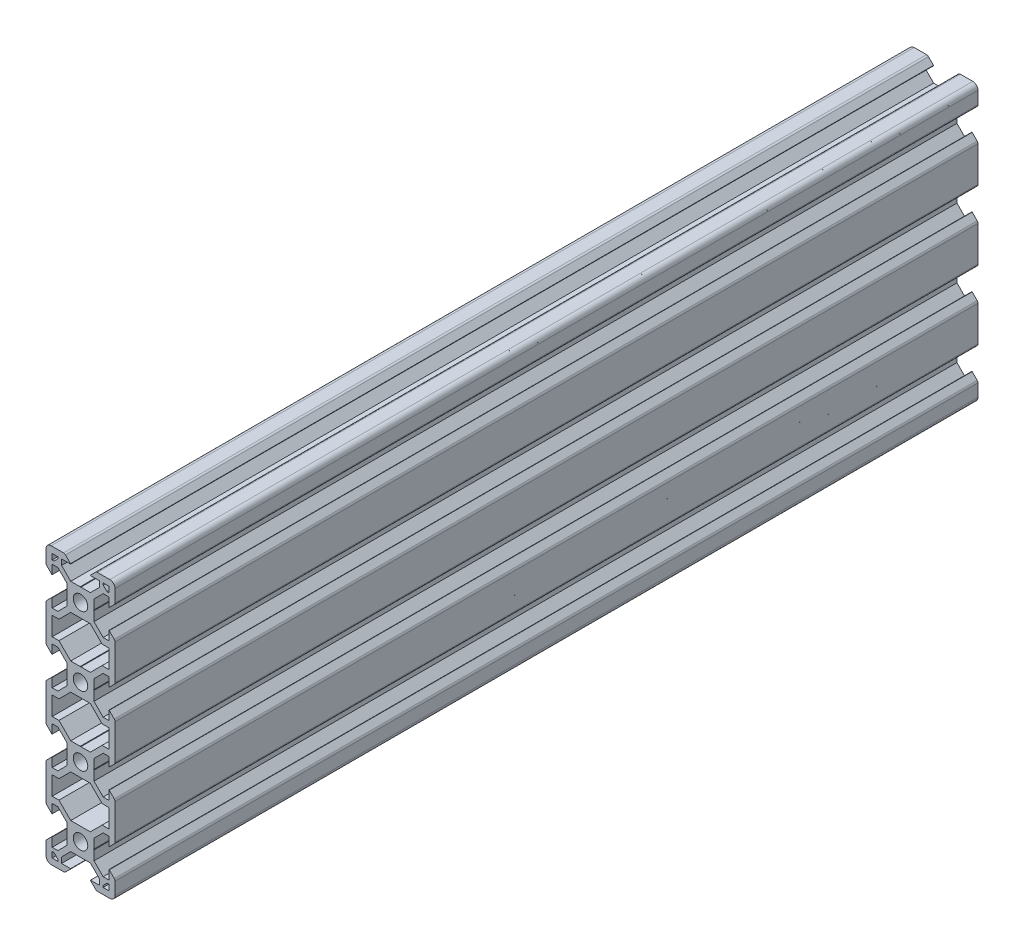
from build123d import *

# Parameters (mm, degrees)
SKETCH3_R           = 2.1
BOSS_EXTRUDE1_DEPTH = 250


with BuildPart() as part:
    # Sketch3 → Boss-Extrude1 (new body)
    with BuildSketch(Plane.XY):
        with BuildLine():
            Line((-0.1, 3.9), (0, 3.8))
            Line((0, 3.8), (0.1, 3.9))
            Line((0.1, 3.9), (2.840365134, 3.9))
            Line((2.840365134, 3.9), (5.5, 6.558825842))
            Line((5.5, 6.558825842), (5.5, 8.197505675))
            Line((5.5, 8.197505675), (2.89, 8.197505675))
            Line((2.89, 8.197505675), (2.89, 8.307505675))
            Line((2.89, 8.307505675), (4.348614357, 9.766120032))
            ThreePointArc((4.348614357, 9.766120032), (4.604908803, 9.937370505), (4.907228714, 9.997505675))
            Line((4.907228714, 9.997505675), (8.5, 9.997505675))
            ThreePointArc((8.5, 9.997505675), (9.560660172, 9.558165846), (10, 8.497505675))
            Line((10, 8.497505675), (10, 4.904734389))
            ThreePointArc((10, 4.904734389), (9.939864831, 4.602414477), (9.768614357, 4.346120032))
            Line((9.768614357, 4.346120032), (8.31, 2.887505675))
            Line((8.31, 2.887505675), (8.2, 2.887505675))
            Line((8.2, 2.887505675), (8.2, 5.497505675))
            Line((8.2, 5.497505675), (6.56, 5.497505675))
            Line((6.56, 5.497505675), (3.9, 2.83831481))
            Line((3.9, 2.83831481), (3.9, 0.1))
            Line((3.9, 0.1), (3.8, 0))
            Line((3.8, 0), (3.9, -0.1))
            Line((3.9, -0.1), (3.9, -2.84))
            Line((3.9, -2.84), (6.56, -5.5))
            Line((6.56, -5.5), (8.21, -5.5))
            Line((8.21, -5.5), (8.21, -2.89))
            Line((8.21, -2.89), (8.31, -2.89))
            Line((8.31, -2.89), (9.765685425, -4.345685425))
            ThreePointArc((9.765685425, -4.345685425), (9.939103626, -4.605224104), (10, -4.91137085))
            Line((10, -4.91137085), (10, -15.08862915))
            ThreePointArc((10, -15.08862915), (9.939103626, -15.394775896), (9.765685425, -15.654314575))
            Line((9.765685425, -15.654314575), (8.31, -17.11))
            Line((8.31, -17.11), (8.21, -17.11))
            Line((8.21, -17.11), (8.21, -14.5))
            Line((8.21, -14.5), (6.56, -14.5))
            Line((6.56, -14.5), (3.9, -17.16))
            Line((3.9, -17.16), (3.9, -19.9))
            Line((3.9, -19.9), (3.8, -20))
            Line((3.8, -20), (3.9, -20.1))
            Line((3.9, -20.1), (3.9, -22.838679656))
            Line((3.9, -22.838679656), (6.56, -25.498679656))
            Line((6.56, -25.498679656), (8.21, -25.498679656))
            Line((8.21, -25.498679656), (8.21, -22.888679656))
            Line((8.21, -22.888679656), (8.31, -22.888679656))
            Line((8.31, -22.888679656), (9.765685425, -24.344365081))
            ThreePointArc((9.765685425, -24.344365081), (9.939103626, -24.60390376), (10, -24.910050506))
            Line((10, -24.910050506), (10, -35.109949494))
            ThreePointArc((10, -35.109949494), (9.939103626, -35.41609624), (9.765685425, -35.675634919))
            Line((9.765685425, -35.675634919), (8.31, -37.131320344))
            Line((8.31, -37.131320344), (8.21, -37.131320344))
            Line((8.21, -37.131320344), (8.21, -34.521320344))
            Line((8.21, -34.521320344), (6.56, -34.521320344))
            Line((6.56, -34.521320344), (3.9, -37.181320344))
            Line((3.9, -37.181320344), (3.9, -39.92))
            Line((3.9, -39.92), (3.8, -40.02))
            Line((3.8, -40.02), (3.9, -40.12))
            Line((3.9, -40.12), (3.9, -42.86))
            Line((3.9, -42.86), (6.56, -45.52))
            Line((6.56, -45.52), (8.21, -45.52))
            Line((8.21, -45.52), (8.21, -42.91))
            Line((8.21, -42.91), (8.31, -42.91))
            Line((8.31, -42.91), (9.765685425, -44.365685425))
            ThreePointArc((9.765685425, -44.365685425), (9.939103626, -44.625224104), (10, -44.93137085))
            Line((10, -44.93137085), (10, -55.10862915))
            ThreePointArc((10, -55.10862915), (9.939103626, -55.414775896), (9.765685425, -55.674314575))
            Line((9.765685425, -55.674314575), (8.31, -57.13))
            Line((8.31, -57.13), (8.21, -57.13))
            Line((8.21, -57.13), (8.21, -54.52))
            Line((8.21, -54.52), (6.56, -54.52))
            Line((6.56, -54.52), (3.9, -57.18))
            Line((3.9, -57.18), (3.9, -59.92))
            Line((3.9, -59.92), (3.8, -60.02))
            Line((3.8, -60.02), (3.9, -60.12))
            Line((3.9, -60.12), (3.9, -62.85831481))
            Line((3.9, -62.85831481), (6.56, -65.517505675))
            Line((6.56, -65.517505675), (8.2, -65.517505675))
            Line((8.2, -65.517505675), (8.2, -62.907505675))
            Line((8.2, -62.907505675), (8.31, -62.907505675))
            Line((8.31, -62.907505675), (9.768614357, -64.366120032))
            ThreePointArc((9.768614357, -64.366120032), (9.939864831, -64.622414477), (10, -64.924734389))
            Line((10, -64.924734389), (10, -68.517505675))
            ThreePointArc((10, -68.517505675), (9.560660172, -69.578165846), (8.5, -70.017505675))
            Line((8.5, -70.017505675), (4.907228714, -70.017505675))
            ThreePointArc((4.907228714, -70.017505675), (4.604908803, -69.957370505), (4.348614357, -69.786120032))
            Line((4.348614357, -69.786120032), (2.89, -68.327505675))
            Line((2.89, -68.327505675), (2.89, -68.217505675))
            Line((2.89, -68.217505675), (5.5, -68.217505675))
            Line((5.5, -68.217505675), (5.5, -66.578825842))
            Line((5.5, -66.578825842), (2.840365134, -63.92))
            Line((2.840365134, -63.92), (0.1, -63.92))
            Line((0.1, -63.92), (0, -63.82))
            Line((0, -63.82), (-0.1, -63.92))
            Line((-0.1, -63.92), (-2.840365134, -63.92))
            Line((-2.840365134, -63.92), (-5.5, -66.578825842))
            Line((-5.5, -66.578825842), (-5.5, -68.217505675))
            Line((-5.5, -68.217505675), (-2.89, -68.217505675))
            Line((-2.89, -68.217505675), (-2.89, -68.327505675))
            Line((-2.89, -68.327505675), (-4.348614357, -69.786120032))
            ThreePointArc((-4.348614357, -69.786120032), (-4.604908803, -69.957370505), (-4.907228714, -70.017505675))
            Line((-4.907228714, -70.017505675), (-8.5, -70.017505675))
            ThreePointArc((-8.5, -70.017505675), (-9.560660172, -69.578165846), (-10, -68.517505675))
            Line((-10, -68.517505675), (-10, -64.924734389))
            ThreePointArc((-10, -64.924734389), (-9.939864831, -64.622414477), (-9.768614357, -64.366120032))
            Line((-9.768614357, -64.366120032), (-8.31, -62.907505675))
            Line((-8.31, -62.907505675), (-8.2, -62.907505675))
            Line((-8.2, -62.907505675), (-8.2, -65.517505675))
            Line((-8.2, -65.517505675), (-6.56, -65.517505675))
            Line((-6.56, -65.517505675), (-3.9, -62.85831481))
            Line((-3.9, -62.85831481), (-3.9, -60.12))
            Line((-3.9, -60.12), (-3.8, -60.02))
            Line((-3.8, -60.02), (-3.9, -59.92))
            Line((-3.9, -59.92), (-3.9, -57.18))
            Line((-3.9, -57.18), (-6.56, -54.52))
            Line((-6.56, -54.52), (-8.21, -54.52))
            Line((-8.21, -54.52), (-8.21, -57.13))
            Line((-8.21, -57.13), (-8.31, -57.13))
            Line((-8.31, -57.13), (-9.765685425, -55.674314575))
            ThreePointArc((-9.765685425, -55.674314575), (-9.939103626, -55.414775896), (-10, -55.10862915))
            Line((-10, -55.10862915), (-10, -44.93137085))
            ThreePointArc((-10, -44.93137085), (-9.939103626, -44.625224104), (-9.765685425, -44.365685425))
            Line((-9.765685425, -44.365685425), (-8.31, -42.91))
            Line((-8.31, -42.91), (-8.21, -42.91))
            Line((-8.21, -42.91), (-8.21, -45.52))
            Line((-8.21, -45.52), (-6.56, -45.52))
            Line((-6.56, -45.52), (-3.9, -42.86))
            Line((-3.9, -42.86), (-3.9, -40.12))
            Line((-3.9, -40.12), (-3.8, -40.02))
            Line((-3.8, -40.02), (-3.9, -39.92))
            Line((-3.9, -39.92), (-3.9, -37.181320344))
            Line((-3.9, -37.181320344), (-6.56, -34.521320344))
            Line((-6.56, -34.521320344), (-8.21, -34.521320344))
            Line((-8.21, -34.521320344), (-8.21, -37.131320344))
            Line((-8.21, -37.131320344), (-8.31, -37.131320344))
            Line((-8.31, -37.131320344), (-9.765685425, -35.675634919))
            ThreePointArc((-9.765685425, -35.675634919), (-9.939103626, -35.41609624), (-10, -35.109949494))
            Line((-10, -35.109949494), (-10, -24.910050506))
            ThreePointArc((-10, -24.910050506), (-9.939103626, -24.60390376), (-9.765685425, -24.344365081))
            Line((-9.765685425, -24.344365081), (-8.31, -22.888679656))
            Line((-8.31, -22.888679656), (-8.21, -22.888679656))
            Line((-8.21, -22.888679656), (-8.21, -25.498679656))
            Line((-8.21, -25.498679656), (-6.56, -25.498679656))
            Line((-6.56, -25.498679656), (-3.9, -22.838679656))
            Line((-3.9, -22.838679656), (-3.9, -20.1))
            Line((-3.9, -20.1), (-3.8, -20))
            Line((-3.8, -20), (-3.9, -19.9))
            Line((-3.9, -19.9), (-3.9, -17.16))
            Line((-3.9, -17.16), (-6.56, -14.5))
            Line((-6.56, -14.5), (-8.21, -14.5))
            Line((-8.21, -14.5), (-8.21, -17.11))
            Line((-8.21, -17.11), (-8.31, -17.11))
            Line((-8.31, -17.11), (-9.765685425, -15.654314575))
            ThreePointArc((-9.765685425, -15.654314575), (-9.939103626, -15.394775896), (-10, -15.08862915))
            Line((-10, -15.08862915), (-10, -4.91137085))
            ThreePointArc((-10, -4.91137085), (-9.939103626, -4.605224104), (-9.765685425, -4.345685425))
            Line((-9.765685425, -4.345685425), (-8.31, -2.89))
            Line((-8.31, -2.89), (-8.21, -2.89))
            Line((-8.21, -2.89), (-8.21, -5.5))
            Line((-8.21, -5.5), (-6.56, -5.5))
            Line((-6.56, -5.5), (-3.9, -2.84))
            Line((-3.9, -2.84), (-3.9, -0.1))
            Line((-3.9, -0.1), (-3.8, 0))
            Line((-3.8, 0), (-3.9, 0.1))
            Line((-3.9, 0.1), (-3.9, 2.83831481))
            Line((-3.9, 2.83831481), (-6.56, 5.497505675))
            Line((-6.56, 5.497505675), (-8.2, 5.497505675))
            Line((-8.2, 5.497505675), (-8.2, 2.887505675))
            Line((-8.2, 2.887505675), (-8.31, 2.887505675))
            Line((-8.31, 2.887505675), (-9.768614357, 4.346120032))
            ThreePointArc((-9.768614357, 4.346120032), (-9.939864831, 4.602414477), (-10, 4.904734389))
            Line((-10, 4.904734389), (-10, 8.497505675))
            ThreePointArc((-10, 8.497505675), (-9.560660172, 9.558165846), (-8.5, 9.997505675))
            Line((-8.5, 9.997505675), (-4.907228714, 9.997505675))
            ThreePointArc((-4.907228714, 9.997505675), (-4.604908803, 9.937370505), (-4.348614357, 9.766120032))
            Line((-4.348614357, 9.766120032), (-2.89, 8.307505675))
            Line((-2.89, 8.307505675), (-2.89, 8.197505675))
            Line((-2.89, 8.197505675), (-5.5, 8.197505675))
            Line((-5.5, 8.197505675), (-5.5, 6.558825842))
            Line((-5.5, 6.558825842), (-2.840365134, 3.9))
            Line((-2.840365134, 3.9), (-0.1, 3.9))
        make_face()
        Circle(SKETCH3_R, mode=Mode.SUBTRACT)
        with Locations((0, -20)):
            Circle(SKETCH3_R, mode=Mode.SUBTRACT)
        with Locations(Location((0, -40.02, 0), (0, 0, 180))):
            Circle(SKETCH3_R, mode=Mode.SUBTRACT)
        with Locations(Location((0, -60.02, 0), (0, 0, 180))):
            Circle(SKETCH3_R, mode=Mode.SUBTRACT)
        Polygon((-7.66, 6.567505675), (-6.57, 7.657505675), (-6.57, 8.197505675), (-8.2, 8.197505675), (-8.2, 6.567505675), align=None, mode=Mode.SUBTRACT)
        Polygon((2.840365134, -3.9), (-2.840365134, -3.9), (-6.25, -7.309634866), (-8.21, -7.309634866), (-8.21, -12.7), (-6.25, -12.7), (-2.85, -16.1), (-0.1, -16.1), (0, -16.2), (0.1, -16.1), (2.85, -16.1), (6.25, -12.7), (8.21, -12.7), (8.21, -7.309634866), (6.25, -7.309634866), align=None, mode=Mode.SUBTRACT)
        Polygon((-0.1, -23.9), (0, -23.8), (0.1, -23.9), (2.84, -23.9), (6.25, -27.31), (8.21, -27.31), (8.21, -32.71), (6.25, -32.71), (2.84, -36.12), (0.1, -36.12), (0, -36.22), (-0.1, -36.12), (-2.84, -36.12), (-6.25, -32.71), (-8.21, -32.71), (-8.21, -27.31), (-6.25, -27.31), (-2.84, -23.9), align=None, mode=Mode.SUBTRACT)
        Polygon((8.2, 6.567505675), (7.66, 6.567505675), (6.57, 7.657505675), (6.57, 8.197505675), (8.2, 8.197505675), align=None, mode=Mode.SUBTRACT)
        Polygon((7.66, -66.587505675), (6.57, -67.677505675), (6.57, -68.217505675), (8.2, -68.217505675), (8.2, -66.587505675), align=None, mode=Mode.SUBTRACT)
        Polygon((2.840365134, -56.12), (6.25, -52.710365134), (8.21, -52.710365134), (8.21, -47.32), (6.25, -47.32), (2.85, -43.92), (0.1, -43.92), (0, -43.82), (-0.1, -43.92), (-2.85, -43.92), (-6.25, -47.32), (-8.21, -47.32), (-8.21, -52.710365134), (-6.25, -52.710365134), (-2.840365134, -56.12), align=None, mode=Mode.SUBTRACT)
        Polygon((-8.2, -66.587505675), (-7.66, -66.587505675), (-6.57, -67.677505675), (-6.57, -68.217505675), (-8.2, -68.217505675), align=None, mode=Mode.SUBTRACT)
    extrude(amount=-BOSS_EXTRUDE1_DEPTH)


solid = part.part
